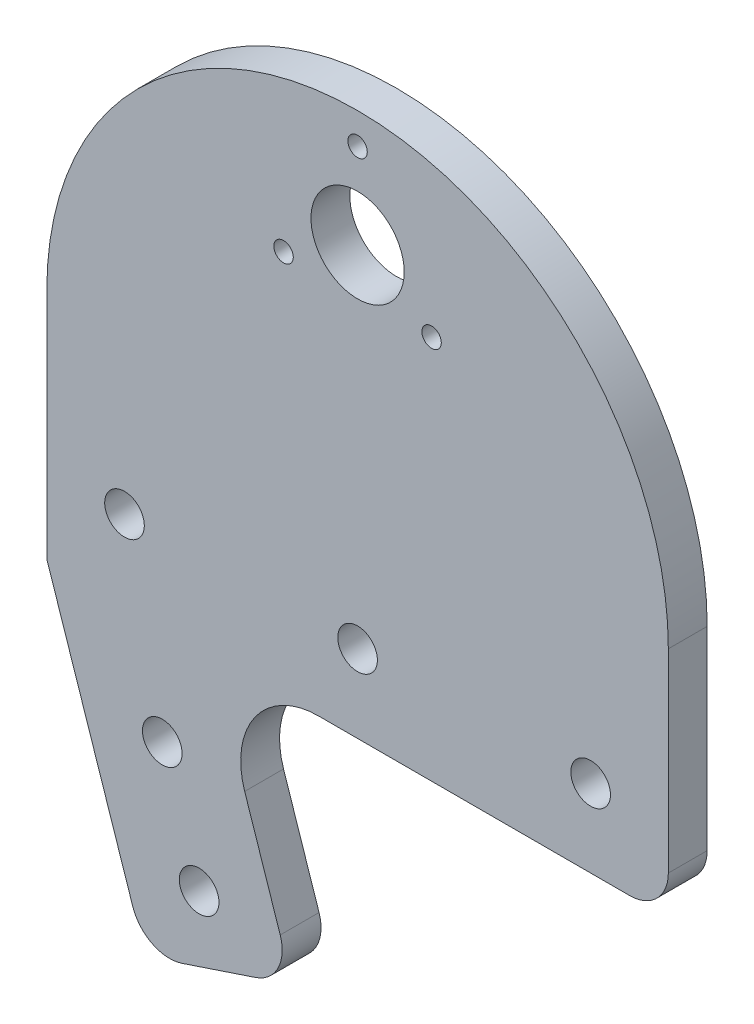
from build123d import *

# Parameters (mm, degrees)
SKETCH_1_R          = 6
SKETCH_1_R_2        = 2.55
EXTRUDE_1_DEPTH     = 5
SKETCH_2_R          = 2.55
EXTRUDE_2_DEPTH     = 5
FILLET_1_R          = 10
FILLET_2_R          = 5
SKETCH_3_R          = 1.25
CUT_EXTRUDE_1_DEPTH = 101.098617334


with BuildPart() as part:
    # ｽｹｯﾁ1 → ﾎﾞｽ - 押し出し1 (new body)
    with BuildSketch(Plane.XY):
        with BuildLine():
            Line((-40, -55), (40, -55))
            Line((40, -55), (40, -25))
            ThreePointArc((40, -25), (0, 15), (-40, -25))
            Line((-40, -25), (-40, -55))
        make_face()
        Circle(SKETCH_1_R, mode=Mode.SUBTRACT)
        with Locations((-30, -45)):
            Circle(SKETCH_1_R_2, mode=Mode.SUBTRACT)
        with Locations((0, -45)):
            Circle(SKETCH_1_R_2, mode=Mode.SUBTRACT)
        with Locations((30, -45)):
            Circle(SKETCH_1_R_2, mode=Mode.SUBTRACT)
    extrude(amount=EXTRUDE_1_DEPTH)

    # ｽｹｯﾁ2 → ﾎﾞｽ - 押し出し2 (add)
    with BuildSketch(Plane.XY.offset(5)):
        Polygon((-27.350889359, -92.947331922), (-40, -55), (-18.918148932, -55), (-8.377223398, -86.622776602), align=None)
        with Locations((-20.393878507, -82.195587877)):
            Circle(SKETCH_2_R, mode=Mode.SUBTRACT)
        with Locations((-25.137294997, -67.965338407)):
            Circle(SKETCH_2_R, mode=Mode.SUBTRACT)
    extrude(amount=-EXTRUDE_2_DEPTH)

    # ﾌｨﾚｯﾄ1
    fillet_1_edges = [part.edges().sort_by_distance(p)[0] for p in [
        (-18.918148932, -55, 2.5),
    ]]
    fillet(fillet_1_edges, radius=FILLET_1_R)

    # ﾌｨﾚｯﾄ2
    fillet_2_edges = [part.edges().sort_by_distance(p)[0] for p in [
        (-8.377223398, -86.622776602, 2.5),
        (-27.350889359, -92.947331922, 2.5),
        (40, -55, 2.5),
    ]]
    fillet(fillet_2_edges, radius=FILLET_2_R)

    # ｽｹｯﾁ3 → ｶｯﾄ - 押し出し1 (cut, through all)
    with BuildSketch(Plane.XY.offset(5)):
        with Locations((0, 11)):
            Circle(SKETCH_3_R)
        with Locations((9.526279442, -5.5)):
            Circle(SKETCH_3_R)
        with Locations((-9.526279442, -5.5)):
            Circle(SKETCH_3_R)
    extrude(amount=-CUT_EXTRUDE_1_DEPTH, mode=Mode.SUBTRACT)


solid = part.part
